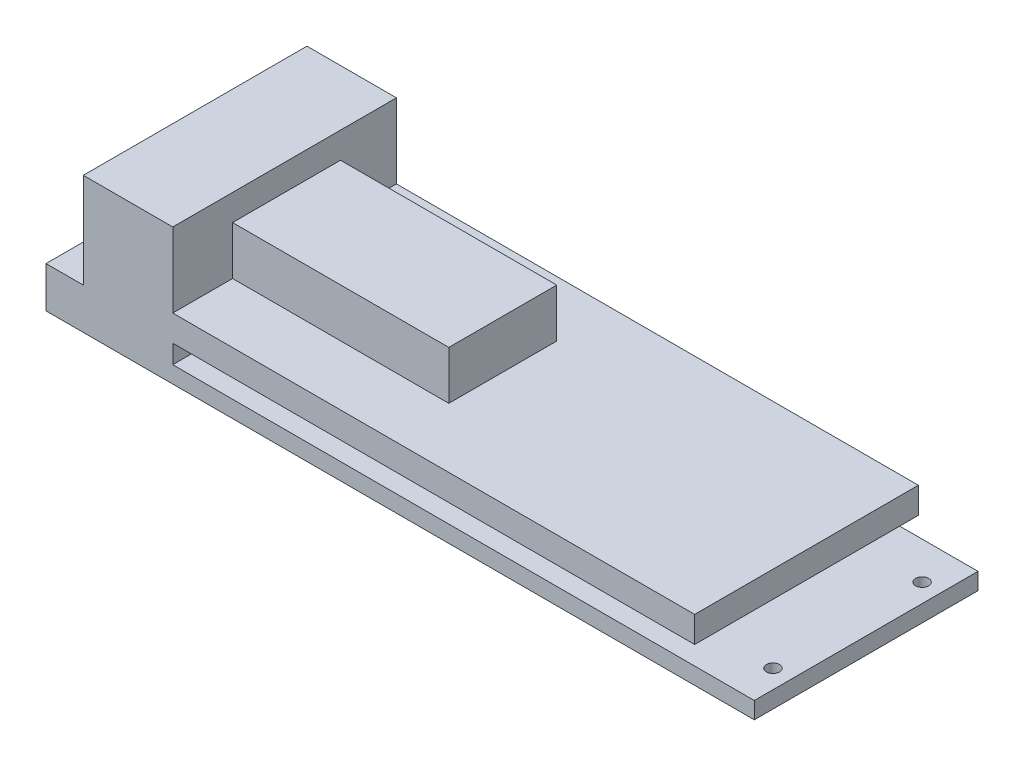
from build123d import *

# Parameters (mm, degrees)
SKETCH1_W           = 190
SKETCH1_H           = 60
SKETCH1_R           = 1.75
BOSS_EXTRUDE1_DEPTH = 4.5
SKETCH2_W           = 10
SKETCH2_H           = 60
BOSS_EXTRUDE2_DEPTH = 6.5
SKETCH3_W           = 24
SKETCH3_H           = 60
BOSS_EXTRUDE3_DEPTH = 32
SKETCH5_W           = 20
SKETCH5_H           = 25
BOSS_EXTRUDE4_DEPTH = 7
SKETCH6_W           = 140
SKETCH6_H           = 60
BOSS_EXTRUDE5_DEPTH = 7
SKETCH7_W           = 58
SKETCH7_H           = 28.953821303
BOSS_EXTRUDE6_DEPTH = 13
SKETCH8_R           = 1.75
CUT_EXTRUDE1_DEPTH  = 13


with BuildPart() as part:
    # Sketch1 → Boss-Extrude1 (new body)
    with BuildSketch(Plane(origin=(0, 0, 0), x_dir=(1, 0, 0), z_dir=(0, 1, 0))):
        Rectangle(SKETCH1_W, SKETCH1_H)
        with Locations(Location((90, -20, 0), (0, 0, 270))):
            Circle(SKETCH1_R, mode=Mode.SUBTRACT)
        with Locations(Location((90, 20, 0), (0, 0, 270))):
            Circle(SKETCH1_R, mode=Mode.SUBTRACT)
    extrude(amount=BOSS_EXTRUDE1_DEPTH)

    # Sketch2 → Boss-Extrude2 (add)
    with BuildSketch(Plane(origin=(0, 4.5, 0), x_dir=(1, 0, 0), z_dir=(0, 1, 0))):
        with Locations((-90, 0)):
            Rectangle(SKETCH2_W, SKETCH2_H)
    extrude(amount=BOSS_EXTRUDE2_DEPTH)

    # Sketch3 → Boss-Extrude3 (add)
    with BuildSketch(Plane(origin=(0, 4.5, 0), x_dir=(1, 0, 0), z_dir=(0, 1, 0))):
        with Locations((-73, 0)):
            Rectangle(SKETCH3_W, SKETCH3_H)
    extrude(amount=BOSS_EXTRUDE3_DEPTH)

    # Sketch5 → Boss-Extrude4 (add)
    with BuildSketch(Plane(origin=(0, 19, 0), x_dir=(1, 0, 0), z_dir=(0, 1, 0))):
        with Locations((-84.226759087, -0.419143158)):
            Rectangle(SKETCH5_W, SKETCH5_H)
    extrude(amount=BOSS_EXTRUDE4_DEPTH)

    # Sketch6 → Boss-Extrude5 (add)
    with BuildSketch(Plane(origin=(0, 9.5, 0), x_dir=(1, 0, 0), z_dir=(0, 1, 0))):
        with Locations((9, 0)):
            Rectangle(SKETCH6_W, SKETCH6_H)
    extrude(amount=BOSS_EXTRUDE5_DEPTH)

    # Sketch7 → Boss-Extrude6 (add)
    with BuildSketch(Plane(origin=(0, 16.5, 0), x_dir=(1, 0, 0), z_dir=(0, 1, 0))):
        with Locations((-32, 0.523089349)):
            Rectangle(SKETCH7_W, SKETCH7_H)
    extrude(amount=BOSS_EXTRUDE6_DEPTH)

    # Sketch8 → Cut-Extrude1 (cut)
    with BuildSketch(Plane.XZ):
        with Locations(Location((-89, -20, 0), (0, 0, 270))):
            Circle(SKETCH8_R)
        with Locations(Location((-89, 19.955464874, 0), (0, 0, 270))):
            Circle(SKETCH8_R)
    extrude(amount=-CUT_EXTRUDE1_DEPTH, mode=Mode.SUBTRACT)


solid = part.part
